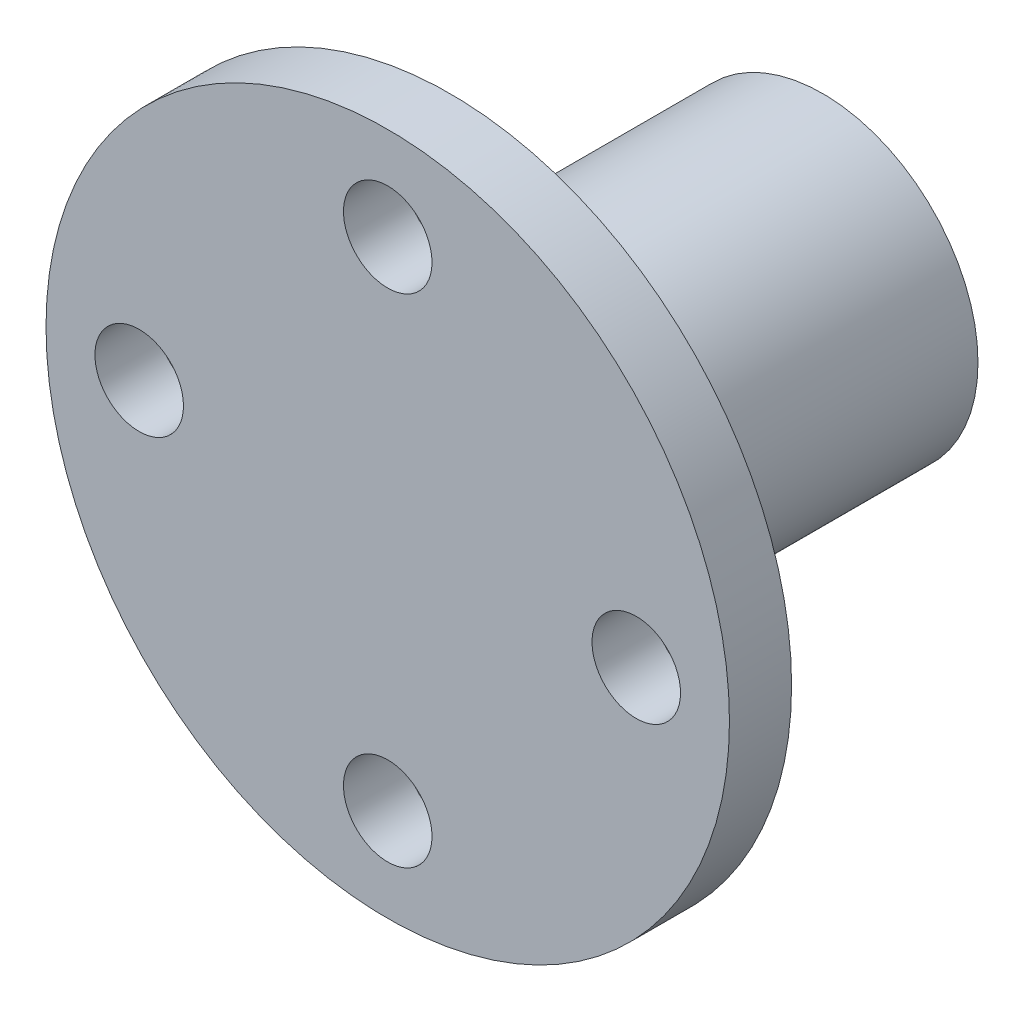
from build123d import *

# Parameters (mm, degrees)
SKETCH1_R           = 11
SKETCH1_R_2         = 1.425
BOSS_EXTRUDE1_DEPTH = 2
SKETCH1_4_R         = 5
SKETCH1_4_R_2       = 1.5
BOSS_EXTRUDE2_DEPTH = 12


with BuildPart() as part:
    # Sketch1 → Boss-Extrude1 (new body)
    with BuildSketch(Plane.XY):
        Circle(SKETCH1_R)
        with Locations((0, -8)):
            Circle(SKETCH1_R_2, mode=Mode.SUBTRACT)
        with Locations((8, 0)):
            Circle(SKETCH1_R_2, mode=Mode.SUBTRACT)
        with Locations((-8, 0)):
            Circle(SKETCH1_R_2, mode=Mode.SUBTRACT)
        with Locations((0, 8)):
            Circle(SKETCH1_R_2, mode=Mode.SUBTRACT)
    extrude(amount=BOSS_EXTRUDE1_DEPTH)

    # Sketch1<4> → Boss-Extrude2 (add)
    with BuildSketch(Plane.XY):
        Circle(SKETCH1_4_R)
        Circle(SKETCH1_4_R_2, mode=Mode.SUBTRACT)
    extrude(amount=-BOSS_EXTRUDE2_DEPTH)


solid = part.part
